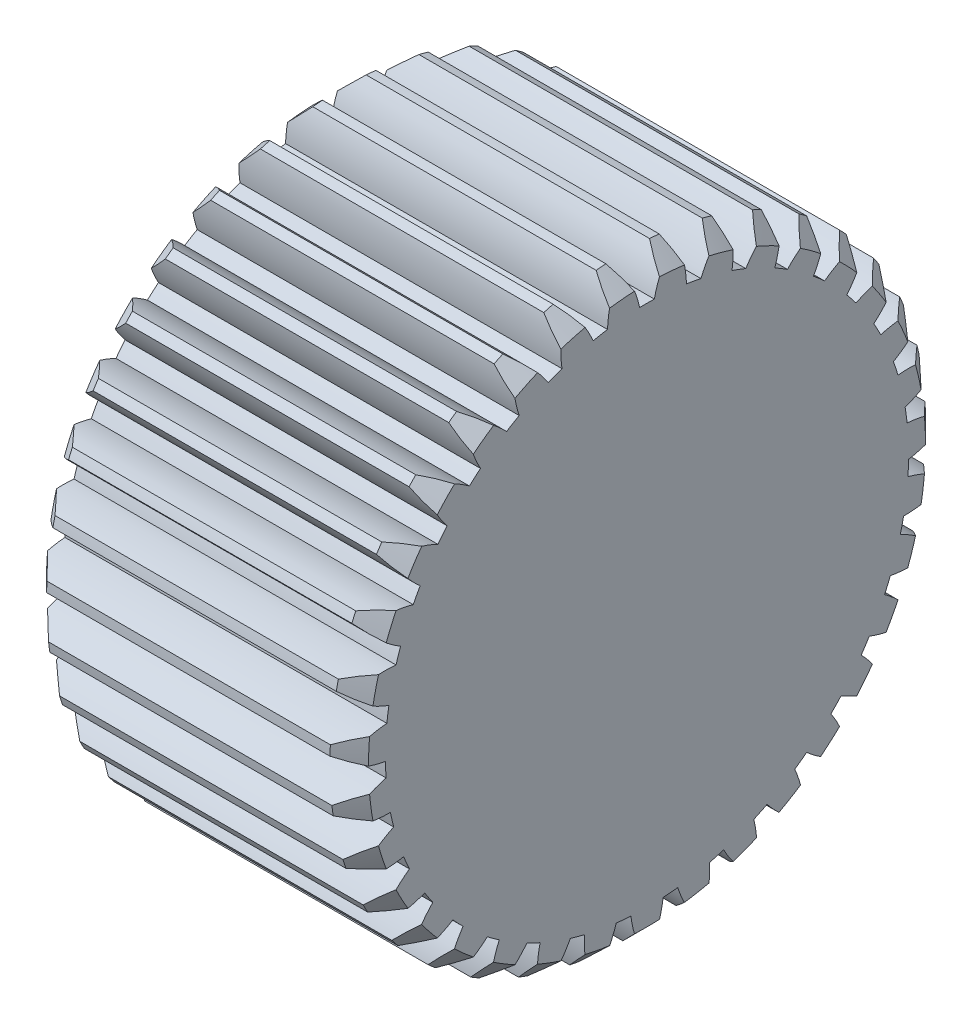
from build123d import *

# Parameters (mm, degrees)
BASPROSKE_W         = 10
BASPROSKE_H         = 9.25
TOOTHCUT_DEPTH      = 17.4658738
TEETHCUTS_COUNT     = 35
TEETHCUTS_ANGLE     = 349.714285714
BORSKE_R            = 2.5
BORE_DEPTH          = 50.0000508
BOSS_EXTRUDE1_START = -10
SKETCH2_R           = 2.5
BOSS_EXTRUDE1_DEPTH = 10
CUT_EXTRUDE1_DEPTH  = 0.5


with BuildPart() as part:
    # BasProSke → Base-Revolve (revolve)
    with BuildSketch(Plane(origin=(0, 0, 0), x_dir=(1, 0, 0), z_dir=(0, 1, 0)), mode=Mode.PRIVATE) as base_revolve_sk:
        with Locations((5, 4.625)):
            Rectangle(BASPROSKE_W, BASPROSKE_H)
    revolve(base_revolve_sk.sketch.rotate(Axis((-10, 0, 0), (1, 0, 0)), 180), axis=Axis((-10, 0, 0), (1, 0, 0)))

    # TooCutSke → ToothCut (cut, through all)
    with BuildSketch(Plane(origin=(0, 0, 0), x_dir=(0, 0, -1), z_dir=(1, 0, 0))):
        with BuildLine():
            ThreePointArc((0.228071263, 8.120797959), (0, 8.124), (-0.228071263, 8.120797959))
            ThreePointArc((-0.228071263, 8.120797959), (-0.411534924, 8.705576187), (-0.694192581, 9.249386024))
            ThreePointArc((-0.694192581, 9.249386024), (0, 9.2754), (0.694192581, 9.249386024))
            ThreePointArc((0.694192581, 9.249386024), (0.411534924, 8.705576187), (0.228071263, 8.120797959))
        make_face()
    toothcut = extrude(amount=TOOTHCUT_DEPTH, mode=Mode.SUBTRACT)

    # TeethCuts: ToothCut ×35 about axis
    teethcuts_axis = Axis((-10, 0, 0), (1, 0, 0))
    for i in range(1, TEETHCUTS_COUNT):
        add(toothcut.rotate(teethcuts_axis, i * TEETHCUTS_ANGLE / (TEETHCUTS_COUNT - 1)), mode=Mode.SUBTRACT)

    # BorSke → Bore (cut, symmetric)
    with BuildSketch(Plane(origin=(0, 0, 0), x_dir=(0, 0, -1), z_dir=(1, 0, 0))):
        with Locations(Location((0, 0, 0), (0, 0, 180))):
            Circle(BORSKE_R)
    extrude(amount=BORE_DEPTH, both=True, mode=Mode.SUBTRACT)

    # Sketch1 → Cut-Revolve1 (revolve, cut)
    with BuildSketch(Plane(origin=(0, 0, 0), x_dir=(1, 0, 0), z_dir=(0, 1, 0))):
        Polygon((0, 9.25), (0.6, 9.25), (0, 8.65), align=None)
        Polygon((10, 8.65), (10, 9.25), (9.4, 9.25), align=None)
    revolve(axis=Axis((0, 0, 0), (-1, 0, 0)), mode=Mode.SUBTRACT)

    # Sketch2 → Boss-Extrude1 (add)
    with BuildSketch(Plane.ZY.offset(BOSS_EXTRUDE1_START)):
        Circle(SKETCH2_R)
    extrude(amount=BOSS_EXTRUDE1_DEPTH)

    # Sketch3 → Cut-Extrude1 (cut)
    with BuildSketch(Plane.ZY):
        with BuildLine():
            Line((-3.012820513, 1.693362089), (-3.461538462, 1.693362089))
            add(Edge.make_bspline(
                [(-3.461538462, 1.693362089), (-3.449381961, 1.743694209), (-3.425616995, 1.842089386), (-3.376049033, 1.982671188), (-3.322050097, 2.11570479), (-3.257208519, 2.238699181), (-3.186481728, 2.354126185), (-3.105449268, 2.459367791), (-3.017849665, 2.557100599), (-2.92095688, 2.643833795), (-2.819344506, 2.722373408), (-2.711580764, 2.789337776), (-2.599833773, 2.846943709), (-2.483329297, 2.894401183), (-2.36172048, 2.930151931), (-2.236106733, 2.956090225), (-2.106158875, 2.972934673), (-2.017948032, 2.974578621), (-1.973157051, 2.975413371)],
                knots=[0, 0, 0, 0, 1.162005537, 2.271625781, 3.343758855, 4.383309926, 5.390229558, 6.379919256, 7.361854164, 8.333198761, 9.295911338, 10.242430842, 11.177959212, 12.116337295, 13.062827104, 14.020064771, 14.994644689, 16, 16, 16, 16], degree=3))
            add(Edge.make_bspline(
                [(-1.973157051, 2.975413371), (-1.907895991, 2.973443042), (-1.778797404, 2.969545363), (-1.589135908, 2.933953311), (-1.406240453, 2.877631693), (-1.232112956, 2.799812083), (-1.070372338, 2.703830207), (-0.9264635, 2.589594868), (-0.802337056, 2.459310152), (-0.69820223, 2.315406489), (-0.616666517, 2.161612904), (-0.556543127, 2.003326965), (-0.519940725, 1.840924149), (-0.515197073, 1.731270893), (-0.512820513, 1.676334845)],
                knots=[0, 0, 0, 0, 1.083050992, 2.142477498, 3.193116406, 4.255571735, 5.30263384, 6.308962982, 7.297363603, 8.282367274, 9.249857812, 10.179914175, 11.08814088, 12, 12, 12, 12], degree=3))
            add(Edge.make_bspline(
                [(-0.512820513, 1.676334845), (-0.514482786, 1.623467996), (-0.517735596, 1.520015775), (-0.545355175, 1.368985065), (-0.591835551, 1.226639921), (-0.656220926, 1.092381118), (-0.739565998, 0.967059919), (-0.840526993, 0.85039436), (-0.95981651, 0.741866992), (-1.050214993, 0.679696316), (-1.096754808, 0.647689012)],
                knots=[0, 0, 0, 0, 1.024540389, 2.004866551, 2.965041327, 3.920577974, 4.882998113, 5.874504559, 6.905732034, 8, 8, 8, 8], degree=3))
            add(Edge.make_bspline(
                [(-1.096754808, 0.647689012), (-1.043566587, 0.62200591), (-0.938185338, 0.571120256), (-0.794541724, 0.471326317), (-0.66414476, 0.356102963), (-0.591425161, 0.266184888), (-0.554887821, 0.22100632)],
                knots=[0, 0, 0, 0, 1.015518401, 2.012035669, 3.001164323, 4, 4, 4, 4], degree=3))
            add(Edge.make_bspline(
                [(-0.554887821, 0.22100632), (-0.53082876, 0.188066674), (-0.483104623, 0.122726794), (-0.424196717, 0.017674757), (-0.370755126, -0.088541657), (-0.329111955, -0.19876938), (-0.296863574, -0.311730828), (-0.273812099, -0.427619965), (-0.259491898, -0.546531426), (-0.257441109, -0.626977826), (-0.256410256, -0.667415155)],
                knots=[0, 0, 0, 0, 1.025084078, 2.033381695, 3.024893161, 4.013698104, 4.991890475, 5.976764909, 6.982997093, 8, 8, 8, 8], degree=3))
            add(Edge.make_bspline(
                [(-0.256410256, -0.667415155), (-0.258973847, -0.737429042), (-0.264088964, -0.877127331), (-0.30980907, -1.08351979), (-0.380685129, -1.285270508), (-0.481337894, -1.478234564), (-0.604005764, -1.658777965), (-0.749944799, -1.820315549), (-0.917496811, -1.959170698), (-1.104362023, -2.07518531), (-1.306815064, -2.167925199), (-1.523351624, -2.232292974), (-1.750851701, -2.274215831), (-1.906862126, -2.278711358), (-1.986177885, -2.280996886)],
                knots=[0, 0, 0, 0, 0.955779014, 1.907060117, 2.875433937, 3.871313158, 4.872415639, 5.851225146, 6.836215519, 7.83643374, 8.849228613, 9.86973379, 10.916971861, 12, 12, 12, 12], degree=3))
            add(Edge.make_bspline(
                [(-1.986177885, -2.280996886), (-2.039634028, -2.279756581), (-2.144817892, -2.277316075), (-2.299451461, -2.260632359), (-2.447053889, -2.230160923), (-2.587824743, -2.189156201), (-2.721889081, -2.137167998), (-2.848837803, -2.072427001), (-2.969451936, -1.996267712), (-3.082593295, -1.907791158), (-3.188248392, -1.808817816), (-3.283609426, -1.697590659), (-3.370266273, -1.576165796), (-3.445898614, -1.443132858), (-3.513951404, -1.300211062), (-3.569924199, -1.14557035), (-3.619189297, -0.980593176), (-3.642094246, -0.865624976), (-3.653846154, -0.806637911)],
                knots=[0, 0, 0, 0, 1.048658725, 2.063410685, 3.046034179, 4.001477787, 4.936774919, 5.862367409, 6.792675028, 7.730719943, 8.675894397, 9.627829632, 10.600096036, 11.597688215, 12.626045268, 13.701542398, 14.82072376, 16, 16, 16, 16], degree=3))
            Line((-3.653846154, -0.806637911), (-3.205128205, -0.806637911))
            add(Edge.make_bspline(
                [(-3.205128205, -0.806637911), (-3.193437789, -0.845136502), (-3.170698914, -0.920019604), (-3.131992774, -1.027791469), (-3.087895242, -1.126588688), (-3.04058873, -1.217136005), (-2.990905235, -1.300325152), (-2.935312485, -1.373956393), (-2.877927992, -1.441263825), (-2.834671773, -1.479184699), (-2.813501603, -1.49774368)],
                knots=[0, 0, 0, 0, 1.198163088, 2.33053128, 3.407730985, 4.417276592, 5.372219308, 6.28897303, 7.162600585, 8, 8, 8, 8], degree=3))
            add(Edge.make_bspline(
                [(-2.813501603, -1.49774368), (-2.785506493, -1.519327015), (-2.729602689, -1.56242706), (-2.638505216, -1.617429386), (-2.542698236, -1.665087994), (-2.440105844, -1.701493274), (-2.332941886, -1.732318503), (-2.219474222, -1.752490674), (-2.100703912, -1.766330918), (-2.019607107, -1.767552249), (-1.978165064, -1.768176373)],
                knots=[0, 0, 0, 0, 0.946170439, 1.889420265, 2.845303464, 3.807233317, 4.801018734, 5.828864929, 6.890507805, 8, 8, 8, 8], degree=3))
            add(Edge.make_bspline(
                [(-1.978165064, -1.768176373), (-1.931374346, -1.767296508), (-1.839879136, -1.765576009), (-1.706372194, -1.74975357), (-1.579361555, -1.726710123), (-1.460257375, -1.691120147), (-1.347499508, -1.647147502), (-1.24266858, -1.591935495), (-1.144388428, -1.527157321), (-1.053917849, -1.453529951), (-0.972567124, -1.372927815), (-0.900939248, -1.288623428), (-0.840046874, -1.200972243), (-0.790927477, -1.109489213), (-0.752140976, -1.014553172), (-0.725736404, -0.915897701), (-0.707377097, -0.814330178), (-0.705881936, -0.745288794), (-0.705128205, -0.710484065)],
                knots=[0, 0, 0, 0, 1.217147791, 2.380027433, 3.494444702, 4.572153297, 5.609568379, 6.639424714, 7.649109417, 8.668170816, 9.669597737, 10.625200337, 11.543417969, 12.441394052, 13.322311151, 14.205496177, 15.095365482, 16, 16, 16, 16], degree=3))
            add(Edge.make_bspline(
                [(-0.705128205, -0.710484065), (-0.70731435, -0.663896438), (-0.711675762, -0.570952998), (-0.744973733, -0.434213606), (-0.799743539, -0.302465874), (-0.876418555, -0.177957602), (-0.96975531, -0.062563457), (-1.078848034, 0.040395803), (-1.204602646, 0.125353076), (-1.320345316, 0.184051157), (-1.422866969, 0.224104121), (-1.510603232, 0.250782642), (-1.608826951, 0.273373579), (-1.716350307, 0.29439111), (-1.833983473, 0.31227875), (-1.961598384, 0.327195629), (-2.099220901, 0.339131402), (-2.194493995, 0.344461538), (-2.243589744, 0.347208243)],
                knots=[0, 0, 0, 0, 1.07054697, 2.135767047, 3.216561865, 4.33974944, 5.486079747, 6.621378074, 7.775625952, 8.963672916, 9.598146892, 10.304877434, 11.070270905, 11.915000392, 12.823868403, 13.805723172, 14.86925407, 16, 16, 16, 16], degree=3))
            Line((-2.243589744, 0.347208243), (-2.243589744, 0.860028755))
            add(Edge.make_bspline(
                [(-2.243589744, 0.860028755), (-2.181730935, 0.861078475), (-2.060564726, 0.863134618), (-1.883572862, 0.888003204), (-1.714325273, 0.922404101), (-1.556572785, 0.975097233), (-1.412788909, 1.036297657), (-1.28804662, 1.107515099), (-1.184093552, 1.186679027), (-1.101434879, 1.275011326), (-1.039250266, 1.369747108), (-0.993783413, 1.468485191), (-0.966925804, 1.572090992), (-0.963340566, 1.64279766), (-0.961538462, 1.67833805)],
                knots=[0, 0, 0, 0, 1.321986639, 2.589447074, 3.816329219, 5.01088745, 6.139805852, 7.153945165, 8.075214402, 8.924034688, 9.728124013, 10.488707548, 11.240355623, 12, 12, 12, 12], degree=3))
            add(Edge.make_bspline(
                [(-0.961538462, 1.67833805), (-0.962130477, 1.704449115), (-0.963308264, 1.756395839), (-0.978161518, 1.832288794), (-1.000481577, 1.905861574), (-1.031166904, 1.976801303), (-1.072238617, 2.04461598), (-1.121390026, 2.109883765), (-1.179915884, 2.17223202), (-1.246980808, 2.230346762), (-1.318997672, 2.285731387), (-1.397925922, 2.332750868), (-1.481385743, 2.3729581), (-1.569469536, 2.406114531), (-1.662463151, 2.431056372), (-1.759929662, 2.448964717), (-1.862054924, 2.460161366), (-1.931728827, 2.461773389), (-1.967147436, 2.462592858)],
                knots=[0, 0, 0, 0, 0.884392785, 1.759457502, 2.611959086, 3.489218968, 4.37281399, 5.2945488, 6.255912374, 7.266815255, 8.301784654, 9.332968512, 10.37626691, 11.440494194, 12.520033166, 13.637162961, 14.798855837, 16, 16, 16, 16], degree=3))
            add(Edge.make_bspline(
                [(-1.967147436, 2.462592858), (-2.02407839, 2.460605198), (-2.135277785, 2.456722836), (-2.295584809, 2.422718531), (-2.444612429, 2.368464126), (-2.55852481, 2.303702669), (-2.642642773, 2.239773478), (-2.702752685, 2.183941498), (-2.761781985, 2.121894607), (-2.815847238, 2.049811214), (-2.870524348, 1.972572942), (-2.920302293, 1.886253397), (-2.968673282, 1.793104262), (-2.997819781, 1.727253356), (-3.012820513, 1.693362089)],
                knots=[0, 0, 0, 0, 1.472543308, 2.876219568, 4.221790263, 5.565193594, 6.249813518, 6.953379497, 7.687249741, 8.463570142, 9.283606569, 10.136032583, 11.040678096, 12, 12, 12, 12], degree=3))
        make_face()
        with BuildLine():
            Line((3.333333333, 2.847208243), (3.333333333, 2.33438773))
            Line((3.333333333, 2.33438773), (1.632612179, 2.33438773))
            Line((1.632612179, 2.33438773), (1.36318109, 1.019283563))
            add(Edge.make_bspline(
                [(1.36318109, 1.019283563), (1.416118053, 1.033898237), (1.518675047, 1.062211857), (1.670046277, 1.093648671), (1.813749425, 1.112599306), (1.906999954, 1.115186892), (1.952123397, 1.116439012)],
                knots=[0, 0, 0, 0, 1.100273476, 2.13160584, 3.095893838, 4, 4, 4, 4], degree=3))
            add(Edge.make_bspline(
                [(1.952123397, 1.116439012), (2.007957311, 1.115230532), (2.117740736, 1.11285436), (2.278367803, 1.090037432), (2.431700508, 1.054123268), (2.577418179, 1.003951094), (2.715790395, 0.939794332), (2.845544054, 0.85965156), (2.968626787, 0.766032516), (3.082830492, 0.658396785), (3.186436647, 0.539937332), (3.277530918, 0.412568945), (3.354906047, 0.277529428), (3.417135697, 0.133528558), (3.466827603, -0.017841661), (3.499901881, -0.178173922), (3.521925751, -0.345956951), (3.524386303, -0.460677765), (3.525641026, -0.519177975)],
                knots=[0, 0, 0, 0, 1.052922333, 2.070308379, 3.05430497, 4.020497103, 4.973039431, 5.925935799, 6.892292201, 7.88610001, 8.88166317, 9.857072816, 10.836096531, 11.812156883, 12.81219415, 13.836441305, 14.89672472, 16, 16, 16, 16], degree=3))
            add(Edge.make_bspline(
                [(3.525641026, -0.519177975), (3.524690918, -0.559924004), (3.522803543, -0.640865415), (3.513205561, -0.761071416), (3.494725966, -0.878732606), (3.469914932, -0.993864595), (3.437711478, -1.106249412), (3.398727115, -1.216208738), (3.351018504, -1.323058176), (3.298687968, -1.42780874), (3.239764428, -1.528092322), (3.17436656, -1.621876588), (3.105273001, -1.710568419), (3.030928165, -1.793216609), (2.950641029, -1.869278063), (2.865383934, -1.93920418), (2.775837192, -2.004177509), (2.680615417, -2.061560645), (2.581840442, -2.114364868), (2.478085846, -2.157684207), (2.371713417, -2.196413533), (2.261192166, -2.227284286), (2.146772433, -2.25147365), (2.028265611, -2.267903079), (1.906293226, -2.279869419), (1.823614636, -2.2806185), (1.781850962, -2.280996886)],
                knots=[0, 0, 0, 0, 1.056347294, 2.098418968, 3.122841568, 4.141288669, 5.149314143, 6.15115421, 7.162517403, 8.180376062, 9.185164535, 10.17417709, 11.141909838, 12.097768115, 13.052685741, 14.0056014, 14.954263652, 15.917497458, 16.885230207, 17.854509472, 18.828990115, 19.81800267, 20.826176721, 21.857883937, 22.917946725, 24, 24, 24, 24], degree=3))
            add(Edge.make_bspline(
                [(1.781850962, -2.280996886), (1.732030703, -2.280009974), (1.634015231, -2.278068343), (1.490414421, -2.257756221), (1.352250698, -2.228664912), (1.220636268, -2.184898812), (1.094391606, -2.130059819), (0.975216295, -2.060751003), (0.860065186, -1.982209426), (0.753619419, -1.889523208), (0.654824971, -1.788215091), (0.566387102, -1.678275603), (0.487624849, -1.561519257), (0.419799496, -1.437379037), (0.36194518, -1.306181136), (0.316495197, -1.167433992), (0.279811833, -1.021862558), (0.264292661, -0.921643257), (0.256410256, -0.870740475)],
                knots=[0, 0, 0, 0, 1.0467383, 2.05933395, 3.04377827, 4.011590433, 4.970194871, 5.932262533, 6.905835911, 7.896367577, 8.894135286, 9.877477877, 10.858688626, 11.851381753, 12.8477658, 13.868841284, 14.917554742, 16, 16, 16, 16], degree=3))
            Line((0.256410256, -0.870740475), (0.705128205, -0.870740475))
            add(Edge.make_bspline(
                [(0.705128205, -0.870740475), (0.716169001, -0.918421122), (0.737390025, -1.010065972), (0.783969666, -1.138825031), (0.840920917, -1.253566779), (0.908641414, -1.35580904), (0.989427172, -1.444964751), (1.081612071, -1.524417697), (1.184965961, -1.596096453), (1.299813432, -1.655843263), (1.420974974, -1.706798625), (1.547785274, -1.740729618), (1.676791483, -1.764588036), (1.764046297, -1.766976266), (1.807892628, -1.768176373)],
                knots=[0, 0, 0, 0, 1.136247022, 2.183929868, 3.172523383, 4.106158343, 5.02341133, 5.958108904, 6.928429099, 7.938127109, 8.96079061, 9.975095812, 10.982467395, 12, 12, 12, 12], degree=3))
            add(Edge.make_bspline(
                [(1.807892628, -1.768176373), (1.850690406, -1.767003833), (1.93495958, -1.764695092), (2.058975847, -1.746925075), (2.178708525, -1.719557116), (2.292976177, -1.67860018), (2.403778377, -1.628822011), (2.508312334, -1.564943331), (2.609602159, -1.491429019), (2.704499492, -1.407205262), (2.791412991, -1.314391413), (2.86820745, -1.215137994), (2.932174469, -1.109256784), (2.986080339, -0.998580852), (3.027013623, -0.881897198), (3.056215025, -0.759752662), (3.073362252, -0.631845548), (3.07572108, -0.544603677), (3.076923077, -0.500147527)],
                knots=[0, 0, 0, 0, 1.027316725, 2.022795036, 3.002884548, 3.971462791, 4.93288096, 5.914575861, 6.907176829, 7.935150275, 8.956128384, 9.956726525, 10.942570165, 11.921478529, 12.907843606, 13.90538589, 14.932640048, 16, 16, 16, 16], degree=3))
            add(Edge.make_bspline(
                [(3.076923077, -0.500147527), (3.075982392, -0.46003931), (3.074141135, -0.381533183), (3.059097463, -0.266677174), (3.03293036, -0.158001399), (2.996610531, -0.054981065), (2.950496949, 0.042480996), (2.894145074, 0.134485368), (2.826497363, 0.219819415), (2.749223236, 0.298523063), (2.664568892, 0.371158599), (2.571077831, 0.433078722), (2.470706507, 0.485170033), (2.364664222, 0.530124316), (2.250428653, 0.562411096), (2.130262035, 0.586650932), (2.002866738, 0.600672879), (1.915765755, 0.602618433), (1.87099359, 0.603618499)],
                knots=[0, 0, 0, 0, 1.045622112, 2.046656509, 3.013763289, 3.955457236, 4.890082067, 5.820317437, 6.762574623, 7.722996705, 8.69280354, 9.665887285, 10.63943826, 11.638615906, 12.663482002, 13.728887084, 14.832589034, 16, 16, 16, 16], degree=3))
            add(Edge.make_bspline(
                [(1.87099359, 0.603618499), (1.832237977, 0.602789083), (1.75221747, 0.60107655), (1.629470574, 0.588467268), (1.500482399, 0.568125419), (1.365747405, 0.540145066), (1.224860965, 0.503529242), (1.078120392, 0.459651384), (0.925217154, 0.407191386), (0.822191834, 0.367573937), (0.769230769, 0.347208243)],
                knots=[0, 0, 0, 0, 0.817624296, 1.688186739, 2.600797293, 3.572016777, 4.590301741, 5.671205678, 6.80286297, 8, 8, 8, 8], degree=3))
            Line((0.769230769, 0.347208243), (1.282051282, 2.847208243))
            Line((1.282051282, 2.847208243), (3.333333333, 2.847208243))
        make_face()
    extrude(amount=-CUT_EXTRUDE1_DEPTH, mode=Mode.SUBTRACT)


solid = part.part
